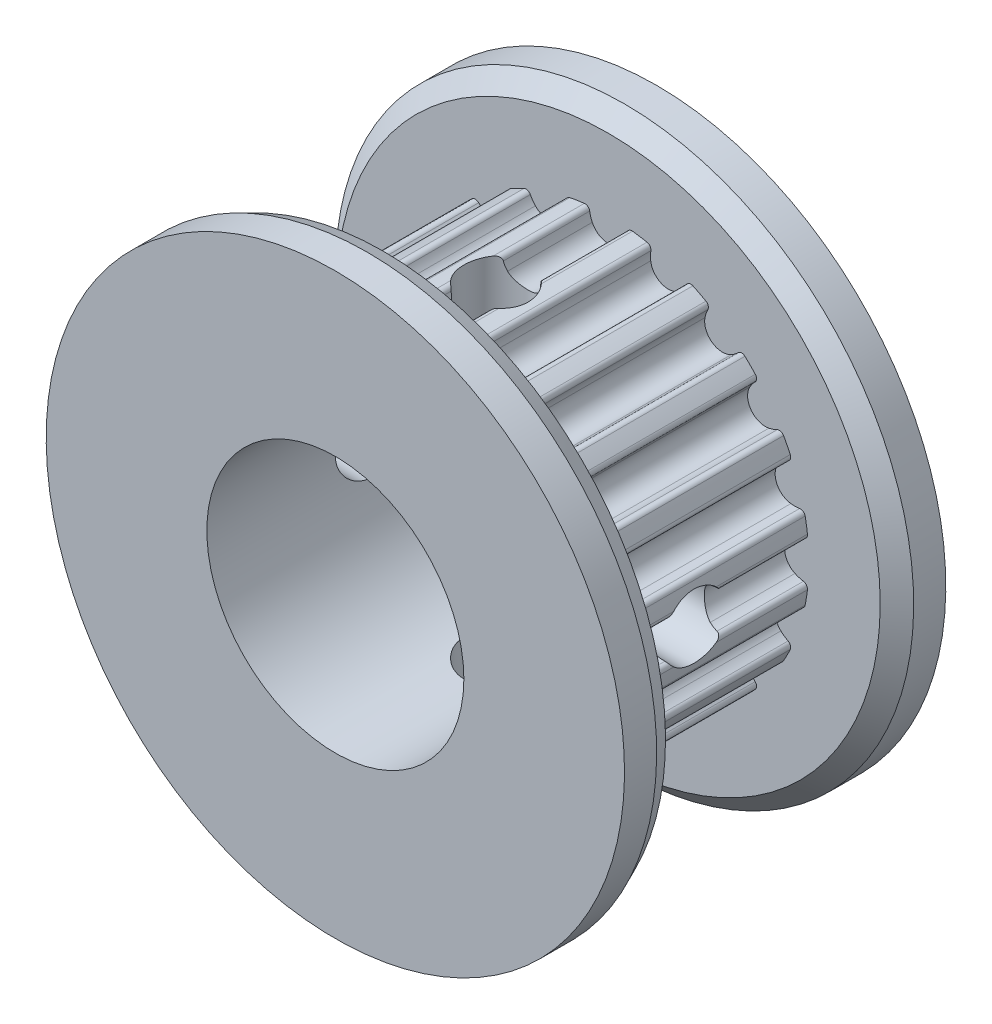
from build123d import *

# Parameters (mm, degrees)
CROQUIS1_R                 = 6.366
SALIENTE_EXTRUIR1_DEPTH    = 7
CORTAR_EXTRUIR1_DEPTH      = 12.404030516
MATRIZC1_COUNT             = 20
CROQUIS6_R                 = 4
CORTAR_EXTRUIR2_DEPTH      = 17.186414056
CORTAR_EXTRUIR3_DEPTH      = 16.305227865
CORTAR_EXTRUIR3_DEPTH_BACK = 16.305227865
CROQUIS7_R                 = 1
CORTAR_EXTRUIR4_DEPTH      = 16.305227921
CORTAR_EXTRUIR4_DEPTH_BACK = 16.305227921
CROQUIS8_R                 = 1


with BuildPart() as part:
    # Croquis1 → Saliente-Extruir1 (new body)
    with BuildSketch(Plane.XY):
        Circle(CROQUIS1_R)
    extrude(amount=SALIENTE_EXTRUIR1_DEPTH)

    # Croquis3 → Cortar-Extruir1 (cut, through all)
    with BuildSketch(Plane(origin=(0, 0, 0), x_dir=(-1, 0, 0), z_dir=(0, 0, -1))):
        with BuildLine():
            Line((-7.140411071, 45.082781216), (-0.995861804, 6.287623976))
            Line((-0.995861804, 6.287623976), (-0.975994627, 6.162187557))
            ThreePointArc((-0.975994627, 6.162187557), (-0.863064611, 6.179016142), (-0.749845546, 6.193775315))
            ThreePointArc((-0.749845546, 6.193775315), (-0.641504612, 6.164627299), (-0.583688192, 6.068478318))
            ThreePointArc((-0.583688192, 6.068478318), (-0.55273127, 5.93441999), (-0.503666473, 5.805879678))
            ThreePointArc((-0.503666473, 5.805879678), (0, 5.484), (0.503666473, 5.805879678))
            ThreePointArc((0.503666473, 5.805879678), (0.55273127, 5.93441999), (0.583688192, 6.068478318))
            ThreePointArc((0.583688192, 6.068478318), (0.641504612, 6.164627299), (0.749845546, 6.193775315))
            ThreePointArc((0.749845546, 6.193775315), (0.863064611, 6.179016142), (0.975994627, 6.162187557))
            Line((0.975994627, 6.162187557), (0.995861804, 6.287623976))
            Line((0.995861804, 6.287623976), (7.140411071, 45.082781216))
            Line((7.140411071, 45.082781216), (7.140411071, 123.640268725))
            Line((7.140411071, 123.640268725), (-7.140411071, 123.640268725))
            Line((-7.140411071, 123.640268725), (-7.140411071, 45.082781216))
        make_face()
    cortar_extruir1 = extrude(amount=-CORTAR_EXTRUIR1_DEPTH, mode=Mode.SUBTRACT)

    # MatrizC1: Cortar-Extruir1 ×20 about axis
    matrizc1_axis = Axis((0, 0, 0), (0, 0, 1))
    for i in range(1, MATRIZC1_COUNT):
        add(cortar_extruir1.rotate(matrizc1_axis, i * 360 / MATRIZC1_COUNT), mode=Mode.SUBTRACT)

    # Croquis5 → Revolución1 (revolve)
    with BuildSketch(Plane(origin=(0, 0, 0), x_dir=(0, 0, -1), z_dir=(1, 0, 0))):
        Polygon((0, 0), (1.5, 0), (1.5, 9), (0.5, 9), (0, 8.458311378), align=None)
        Polygon((-7, 0), (-8.5, 0), (-8.5, 9), (-7.5, 9), (-7, 8.776025475), align=None)
    revolve(axis=Axis((0, 0, 7), (0, 0, 1)))

    # Croquis6 → Cortar-Extruir2 (cut, through all)
    with BuildSketch(Plane.XY.offset(8.5)):
        Circle(CROQUIS6_R)
    extrude(amount=-CORTAR_EXTRUIR2_DEPTH, mode=Mode.SUBTRACT)

    # Croquis7 → Cortar-Extruir3 (cut, two sides: drawn at the far end of the back side and taken through both)
    with BuildSketch(Plane(origin=(0, 0, 0), x_dir=(0, 0, -1), z_dir=(1, 0, 0)).offset(-CORTAR_EXTRUIR3_DEPTH_BACK)):
        with Locations((-3.5, 0)):
            Circle(CROQUIS7_R)
    extrude(amount=CORTAR_EXTRUIR3_DEPTH + CORTAR_EXTRUIR3_DEPTH_BACK, mode=Mode.SUBTRACT)

    # Croquis8 → Cortar-Extruir4 (cut, two sides: drawn at the far end of the back side and taken through both)
    with BuildSketch(Plane(origin=(0, 0, 0), x_dir=(1, 0, 0), z_dir=(0, 1, 0)).offset(-CORTAR_EXTRUIR4_DEPTH_BACK)):
        with Locations(Location((0, -3.5, 0), (0, 0, 270))):
            Circle(CROQUIS8_R)
    extrude(amount=CORTAR_EXTRUIR4_DEPTH + CORTAR_EXTRUIR4_DEPTH_BACK, mode=Mode.SUBTRACT)


solid = part.part
